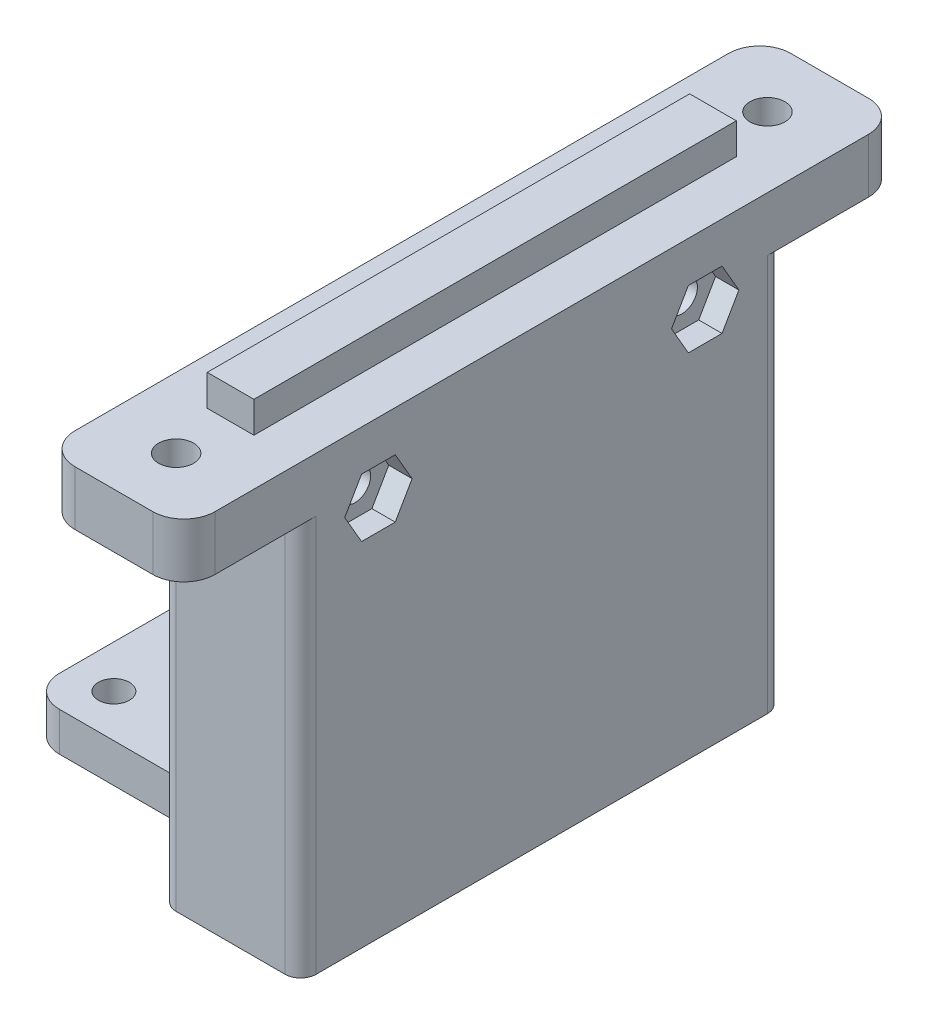
from build123d import *

# Parameters (mm, degrees)
SKETCH_1_W           = 45
SKETCH_1_H           = 42
EXTRUDE_1_DEPTH      = 5
SKETCH_3_R           = 14.775
SKETCH_3_R_2         = 2
CUT_EXTRUDE_1_DEPTH  = 13
SKETCH_7_W           = 18
SKETCH_7_H           = 5
EXTRUDE_3_DEPTH      = 10
SKETCH_8_W           = 18
SKETCH_8_H           = 5
EXTRUDE_4_DEPTH      = 10
EXTRUDE_5_DEPTH      = 53
EXTRUDE_6_DEPTH      = 15
EXTRUDE_6_DEPTH_BACK = 77
SKETCH_11_W          = 18
SKETCH_11_H          = 7
SKETCH_12_W          = 57
SKETCH_12_H          = 14
CUT_EXTRUDE_2_DEPTH  = 10
SKETCH_15_R          = 2.25
CUT_EXTRUDE_5_DEPTH  = 10
SKETCH_16_W          = 6
SKETCH_16_H          = 62
EXTRUDE_7_DEPTH      = 4
SKETCH_17_W          = 5
SKETCH_17_H          = 9.7027375
EXTRUDE_8_DEPTH      = 42
SKETCH_13_R          = 2
CUT_EXTRUDE_3_DEPTH  = 16
CUT_EXTRUDE_4_DEPTH  = 3
FILLET_1_R           = 4
FILLET_2_R           = 2


with BuildPart() as part:
    # Эскиз1 → Бобышка-Вытянуть1 (new body)
    with BuildSketch(Plane(origin=(0, 0, 0), x_dir=(1, 0, 0), z_dir=(0, 1, 0))):
        with Locations((22.5, 21)):
            Rectangle(SKETCH_1_W, SKETCH_1_H)
    extrude(amount=EXTRUDE_1_DEPTH)

    # Эскиз3 → Вырез-Вытянуть1 (cut)
    with BuildSketch(Plane.XZ):
        with Locations(Location((21, -21, 0), (0, 0, 270))):
            Circle(SKETCH_3_R)
        with Locations(Location((36.5, -5.5, 0), (0, 0, 270))):
            Circle(SKETCH_3_R_2)
        with Locations(Location((5.5, -5.5, 0), (0, 0, 270))):
            Circle(SKETCH_3_R_2)
        with Locations(Location((5.5, -36.5, 0), (0, 0, 270))):
            Circle(SKETCH_3_R_2)
        with Locations(Location((36.5, -36.5, 0), (0, 0, 270))):
            Circle(SKETCH_3_R_2)
    extrude(amount=-CUT_EXTRUDE_1_DEPTH, mode=Mode.SUBTRACT)

    # Эскиз7 → Бобышка-Вытянуть3 (add)
    with BuildSketch(Plane.XY):
        with Locations((36, 2.5)):
            Rectangle(SKETCH_7_W, SKETCH_7_H)
    extrude(amount=EXTRUDE_3_DEPTH)

    # Эскиз8 → Бобышка-Вытянуть4 (add)
    with BuildSketch(Plane(origin=(0, 0, -42), x_dir=(-1, 0, 0), z_dir=(0, 0, -1))):
        with Locations((-36, 2.5)):
            Rectangle(SKETCH_8_W, SKETCH_8_H)
    extrude(amount=EXTRUDE_4_DEPTH)

    # Эскиз10 → Бобышка-Вытянуть5 (add)
    with BuildSketch(Plane(origin=(0, 5, 0), x_dir=(1, 0, 0), z_dir=(0, 1, 0))):
        Polygon((27, 52), (45, 52), (45, -10), (27, -10), (27, 0), (42, 0), (42, 42), (27, 42), align=None)
    extrude(amount=EXTRUDE_5_DEPTH)

    # Эскиз11 → Бобышка-Вытянуть6 (add, two sides: drawn at the far end of the back side and taken through both)
    with BuildSketch(Plane(origin=(0, 0, -52), x_dir=(-1, 0, 0), z_dir=(0, 0, -1)).offset(-EXTRUDE_6_DEPTH_BACK)):
        with Locations((-36, 54.5)):
            Rectangle(SKETCH_11_W, SKETCH_11_H)
    extrude(amount=EXTRUDE_6_DEPTH + EXTRUDE_6_DEPTH_BACK)

    # Эскиз12 → Вырез-Вытянуть2 (cut)
    with BuildSketch(Plane.ZY.offset(-27)):
        with Locations((-21, 49)):
            Rectangle(SKETCH_12_W, SKETCH_12_H)
    extrude(amount=-CUT_EXTRUDE_2_DEPTH, mode=Mode.SUBTRACT)

    # Эскиз15 → Вырез-Вытянуть5 (cut)
    with BuildSketch(Plane(origin=(0, 58, 0), x_dir=(1, 0, 0), z_dir=(0, 1, 0))):
        with Locations(Location((36, -17, 0), (0, 0, 270))):
            Circle(SKETCH_15_R)
        with Locations(Location((36, 59, 0), (0, 0, 270))):
            Circle(SKETCH_15_R)
    extrude(amount=-CUT_EXTRUDE_5_DEPTH, mode=Mode.SUBTRACT)

    # Эскиз16 → Бобышка-Вытянуть7 (add)
    with BuildSketch(Plane(origin=(0, 58, 0), x_dir=(1, 0, 0), z_dir=(0, 1, 0))):
        with Locations((36, 21)):
            Rectangle(SKETCH_16_W, SKETCH_16_H)
    extrude(amount=EXTRUDE_7_DEPTH)

    # Эскиз17 → Бобышка-Вытянуть8 (add)
    with BuildSketch(Plane.XY.offset(-42)):
        with Locations((39.5, 46.85136875)):
            Rectangle(SKETCH_17_W, SKETCH_17_H)
    extrude(amount=EXTRUDE_8_DEPTH)

    # Эскиз13 → Вырез-Вытянуть3 (cut)
    with BuildSketch(Plane.ZY.offset(-45)):
        with Locations((-42, 49)):
            Circle(SKETCH_13_R)
        with Locations((0, 49)):
            Circle(SKETCH_13_R)
    extrude(amount=CUT_EXTRUDE_3_DEPTH, mode=Mode.SUBTRACT)

    # Эскиз14 → Вырез-Вытянуть4 (cut)
    with BuildSketch(Plane(origin=(45, 0, 0), x_dir=(0, 0, -1), z_dir=(1, 0, 0))):
        Polygon((2.165063509, 52.75), (-2.165063509, 52.75), (-4.330127019, 49), (-2.165063509, 45.25), (2.165063509, 45.25), (4.330127019, 49), align=None)
        Polygon((44.165063509, 52.75), (39.834936491, 52.75), (37.669872981, 49), (39.834936491, 45.25), (44.165063509, 45.25), (46.330127019, 49), align=None)
    extrude(amount=-CUT_EXTRUDE_4_DEPTH, mode=Mode.SUBTRACT)

    # Скругление1
    fillet_1_edges = [part.edges().sort_by_distance(p)[0] for p in [
        (27, 23.5, 0),
        (27, 23.5, -42),
        (0, 2.5, -42),
        (0, 2.5, 0),
        (45, 54.5, 25),
        (27, 54.5, 25),
        (45, 54.5, -67),
        (27, 54.5, -67),
    ]]
    fillet(fillet_1_edges, radius=FILLET_1_R)

    # Скругление2
    fillet_2_edges = [part.edges().sort_by_distance(p)[0] for p in [
        (45, 25.5, 10),
        (27, 25.5, -52),
        (45, 25.5, -52),
        (27, 25.5, 10),
    ]]
    fillet(fillet_2_edges, radius=FILLET_2_R)


solid = part.part
